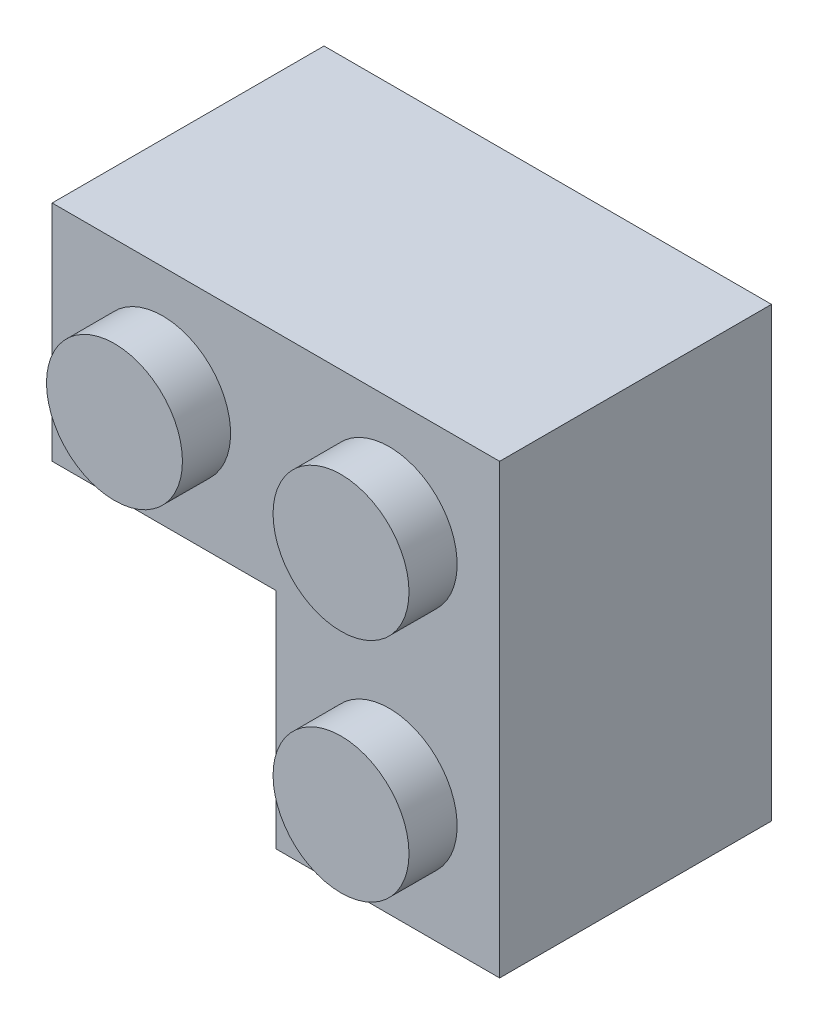
from build123d import *

# Parameters (mm, degrees)
EXTRUDE_1_DEPTH     = 9.6
SKETCH_2_R          = 2.4
EXTRUDE_2_DEPTH     = 1.7
SKETCH_3_R          = 2.5
CUT_EXTRUDE_1_DEPTH = 1.8


with BuildPart() as part:
    # Эскиз1 → Бобышка-Вытянуть1 (new body)
    with BuildSketch(Plane.XY):
        Polygon((7.9, 7.9), (-7.9, 7.9), (-7.9, 0), (0, 0), (0, -7.9), (7.9, -7.9), align=None)
    extrude(amount=EXTRUDE_1_DEPTH)

    # Эскиз2 → Бобышка-Вытянуть2 (add)
    with BuildSketch(Plane.XY.offset(9.6)):
        with Locations(Location((-4, 4, 0), (0, 0, 180))):
            Circle(SKETCH_2_R)
        with Locations(Location((4, 4, 0), (0, 0, 180))):
            Circle(SKETCH_2_R)
        with Locations(Location((4, -4, 0), (0, 0, 180))):
            Circle(SKETCH_2_R)
    extrude(amount=EXTRUDE_2_DEPTH)

    # Эскиз3 → Вырез-Вытянуть1 (cut)
    with BuildSketch(Plane(origin=(0, 0, 0), x_dir=(-1, 0, 0), z_dir=(0, 0, -1))):
        with Locations((4, 4)):
            Circle(SKETCH_3_R)
        with Locations((-4, 4)):
            Circle(SKETCH_3_R)
        with Locations((-4, -4)):
            Circle(SKETCH_3_R)
    extrude(amount=-CUT_EXTRUDE_1_DEPTH, mode=Mode.SUBTRACT)


solid = part.part
